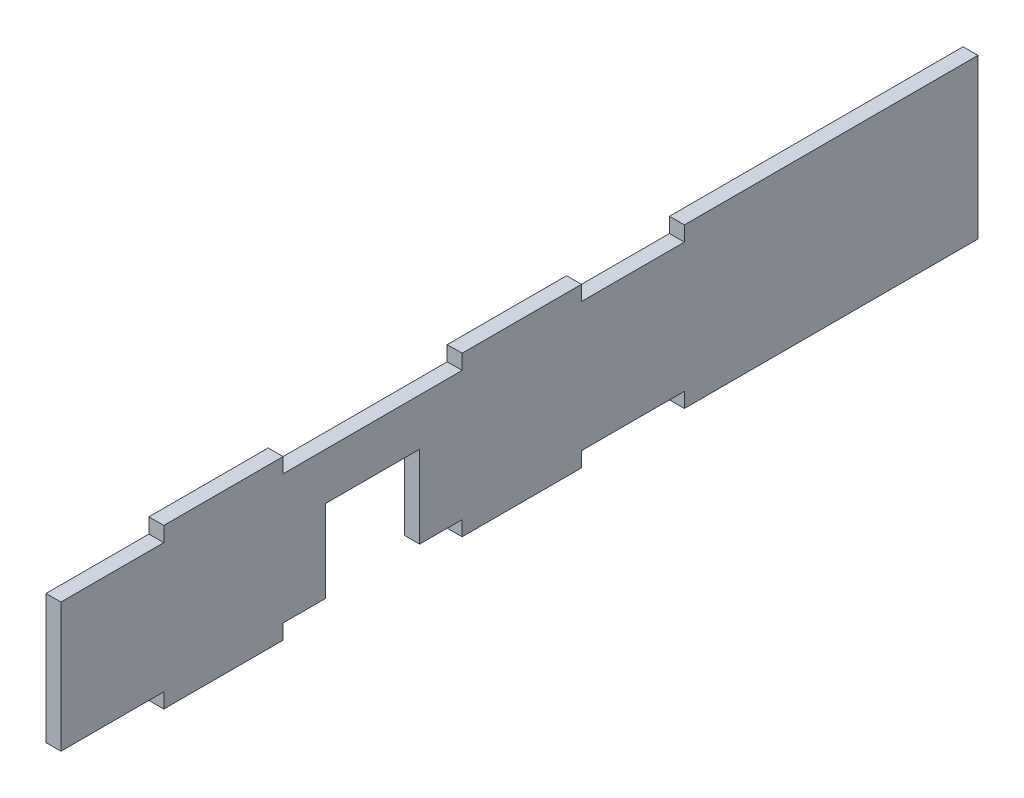
from build123d import *

# Parameters (mm, degrees)
BOSS_EXTRUDE1_DEPTH = 6.35
SKETCH4_W           = 6.35
SKETCH4_H           = 237.700000096
SKETCH4_H_2         = 112.7
BOSS_EXTRUDE2_DEPTH = 6.35
SKETCH5_W           = 6.35
SKETCH5_H           = 390.400000096
BOSS_EXTRUDE3_DEPTH = 6.35
SKETCH6_W           = 76.2
SKETCH6_H           = 6.35
SKETCH6_W_2         = 43.8
CUT_EXTRUDE1_DEPTH  = 265.978178443


with BuildPart() as part:
    # Sketch3 → Boss-Extrude1 (new body)
    with BuildSketch(Plane(origin=(0, 0, 0), x_dir=(0, 0, -1), z_dir=(1, 0, 0))):
        Polygon((-132.7, 55.000000012), (-132.7, 0), (-20, 0), (-20, 35), (20, 35), (20, 0), (257.700000096, 0), (257.700000096, 55.000000012), align=None)
    extrude(amount=BOSS_EXTRUDE1_DEPTH)

    # Sketch4 → Boss-Extrude2 (add)
    with BuildSketch(Plane.XZ):
        with Locations((3.175, -138.850000048)):
            Rectangle(SKETCH4_W, SKETCH4_H)
        with Locations((3.175, 76.35)):
            Rectangle(SKETCH4_W, SKETCH4_H_2)
    extrude(amount=BOSS_EXTRUDE2_DEPTH)

    # Sketch5 → Boss-Extrude3 (add)
    with BuildSketch(Plane(origin=(0, 55.000000012, 0), x_dir=(1, 0, 0), z_dir=(0, 1, 0))):
        with Locations((3.175, 62.500000048)):
            Rectangle(SKETCH5_W, SKETCH5_H)
    extrude(amount=BOSS_EXTRUDE3_DEPTH)

    # Sketch6 → Cut-Extrude1 (cut, through all)
    with BuildSketch(Plane(origin=(6.35, 0, 0), x_dir=(0, 0, -1), z_dir=(1, 0, 0))):
        Polygon((-132.7, 55.000000012), (-126.35, 55.000000012), (-88.9, 55.000000012), (-88.9, 61.350000012), (-132.7, 61.350000012), align=None)
        Polygon((-88.9, 0), (-126.35, 0), (-132.7, 0), (-132.7, -6.35), (-88.9, -6.35), align=None)
        with Locations((0, 58.175000012)):
            Rectangle(SKETCH6_W, SKETCH6_H)
        Polygon((26.35, 0), (20, 0), (20, -6.35), (38.1, -6.35), (38.1, 0), align=None)
        Polygon((-26.35, 0), (-38.1, 0), (-38.1, -6.35), (-20, -6.35), (-20, 0), align=None)
        with Locations((110.8, 58.175000012)):
            Rectangle(SKETCH6_W_2, SKETCH6_H)
        with Locations((110.8, -3.175)):
            Rectangle(SKETCH6_W_2, SKETCH6_H)
    extrude(amount=-CUT_EXTRUDE1_DEPTH, mode=Mode.SUBTRACT)


solid = part.part
